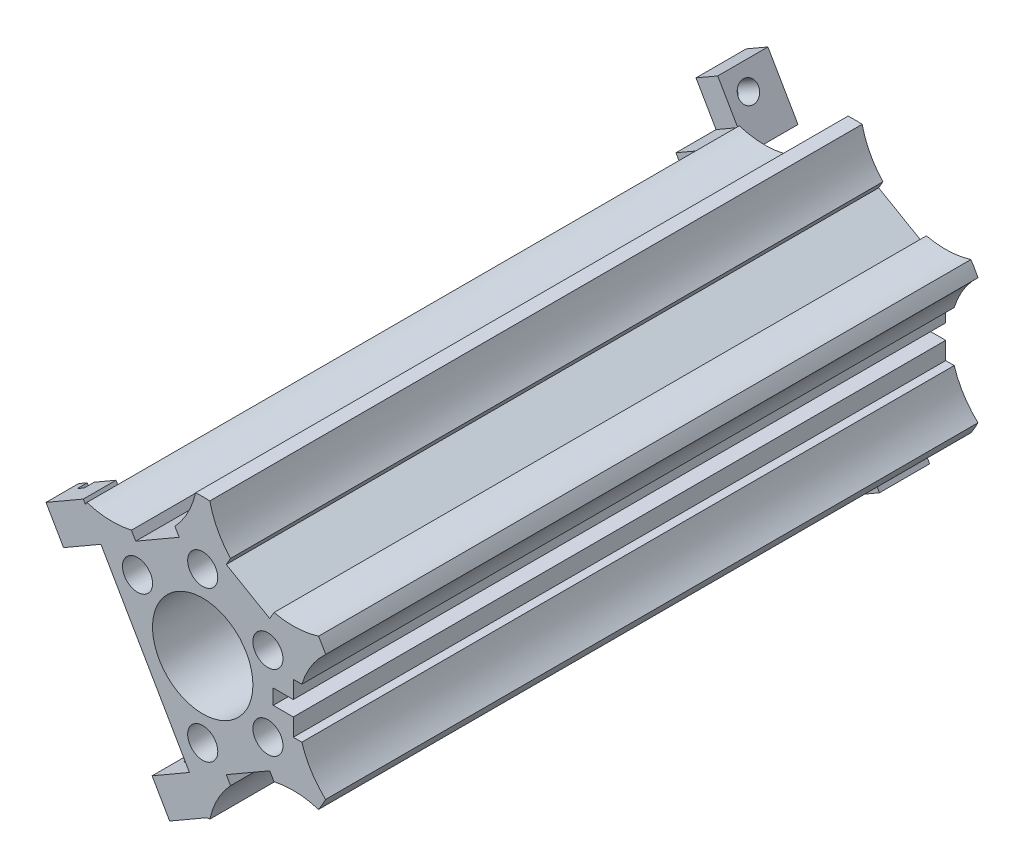
from build123d import *

# Parameters (mm, degrees)
BOSS_EXTRU_1_DEPTH      = 130
ESQUISSE4_R             = 54.250129783
ESQUISSE4_R_2           = 27.5
ENL_V_MAT_EXTRU_1_DEPTH = 150.53980461
ESQUISSE5_R             = 10
ESQUISSE5_R_2           = 3
ENL_V_MAT_EXTRU_2_DEPTH = 136.114727886
BOSS_EXTRU_2_DEPTH      = 5
ESQUISSE6_R             = 2
ENL_V_MAT_EXTRU_3_DEPTH = 140.046443052
BOSS_EXTRU_3_DEPTH      = 49.27879
ENL_V_START             = -8.6
ESQUISSE9_W             = 6.5
ESQUISSE9_H             = 35.278790482
ESQUISSE9_W_2           = 18
ESQUISSE9_H_2           = 40.466483264
ENL_V_MAT_EXTRU_4_DEPTH = 8.6


with BuildPart() as part:
    # Esquisse1 → Boss.-Extru.1 (new body)
    with BuildSketch(Plane.XY):
        with BuildLine():
            Line((-18, -51.176914536), (-18, -48.176914536))
            ThreePointArc((-18, -48.176914536), (-9.5, -16.454482672), (-32.722431864, -39.676914536))
            Line((-32.722431864, -39.676914536), (-35.320508076, -41.176914536))
            ThreePointArc((-35.320508076, -41.176914536), (-37.98683472, -30.451354144), (-34.549834435, -19.947356212))
            ThreePointArc((-34.549834435, -19.947356212), (-45.365063628, -17.671886805), (-53.320508076, -10))
            Line((-53.320508076, -10), (-50.722431864, -8.5))
            ThreePointArc((-50.722431864, -8.5), (-19, 0), (-50.722431864, 8.5))
            Line((-50.722431864, 8.5), (-53.320508076, 10))
            ThreePointArc((-53.320508076, 10), (-45.365063628, 17.671886805), (-34.549834435, 19.947356212))
            ThreePointArc((-34.549834435, 19.947356212), (-37.98683472, 30.451354144), (-35.320508076, 41.176914536))
            Line((-35.320508076, 41.176914536), (-32.722431864, 39.676914536))
            ThreePointArc((-32.722431864, 39.676914536), (-9.5, 16.454482672), (-18, 48.176914536))
            Line((-18, 48.176914536), (-18, 51.176914536))
            ThreePointArc((-18, 51.176914536), (-7.378228908, 48.123240948), (0, 39.894712423))
            ThreePointArc((0, 39.894712423), (7.378228908, 48.123240948), (18, 51.176914536))
            Line((18, 51.176914536), (18, 48.176914536))
            ThreePointArc((18, 48.176914536), (9.5, 16.454482672), (32.722431864, 39.676914536))
            Line((32.722431864, 39.676914536), (35.320508076, 41.176914536))
            ThreePointArc((35.320508076, 41.176914536), (37.98683472, 30.451354144), (34.549834435, 19.947356212))
            ThreePointArc((34.549834435, 19.947356212), (45.365063628, 17.671886805), (53.320508076, 10))
            Line((53.320508076, 10), (50.722431864, 8.5))
            ThreePointArc((50.722431864, 8.5), (19, 0), (50.722431864, -8.5))
            Line((50.722431864, -8.5), (53.320508076, -10))
            ThreePointArc((53.320508076, -10), (45.365063628, -17.671886805), (34.549834435, -19.947356212))
            ThreePointArc((34.549834435, -19.947356212), (37.98683472, -30.451354144), (35.320508076, -41.176914536))
            Line((35.320508076, -41.176914536), (32.722431864, -39.676914536))
            ThreePointArc((32.722431864, -39.676914536), (9.5, -16.454482672), (18, -48.176914536))
            Line((18, -48.176914536), (18, -51.176914536))
            ThreePointArc((18, -51.176914536), (7.378228908, -48.123240948), (0, -39.894712423))
            ThreePointArc((0, -39.894712423), (-7.378228908, -48.123240948), (-18, -51.176914536))
        make_face()
    extrude(amount=BOSS_EXTRU_1_DEPTH)

    # Esquisse4 → Enlèv. mat.-Extru.1 (cut, through all)
    with BuildSketch(Plane.XY.offset(130)):
        Circle(ESQUISSE4_R)
        Circle(ESQUISSE4_R_2, mode=Mode.SUBTRACT)
    extrude(amount=-ENL_V_MAT_EXTRU_1_DEPTH, mode=Mode.SUBTRACT)

    # Esquisse5 → Enlèv. mat.-Extru.2 (cut, through all)
    with BuildSketch(Plane.XY.offset(130)):
        Circle(ESQUISSE5_R)
        with Locations((0, 15)):
            Circle(ESQUISSE5_R_2)
        with Locations((12.990381057, 7.5)):
            Circle(ESQUISSE5_R_2)
        with Locations((12.990381057, -7.5)):
            Circle(ESQUISSE5_R_2)
        with Locations((0, -15)):
            Circle(ESQUISSE5_R_2)
        with Locations((-12.990381057, 7.5)):
            Circle(ESQUISSE5_R_2)
        Polygon((14.206088614, -14.605667257), (5.545834576, -19.605667257), (4.695834576, -18.13342407), (13.356088614, -13.13342407), align=None)
        Polygon((18.051923191, 5), (19.751923191, 5), (19.751923191, -5), (18.051923191, -5), (18.051923191, -1.5), (14.051923191, -1.5), (14.051923191, 1.5), (18.051923191, 1.5), align=None)
        Polygon((-14.206088614, 14.605667257), (-5.545834576, 19.605667257), (-4.695834576, 18.13342407), (-13.356088614, 13.13342407), align=None)
        Polygon((5.545834576, 19.605667257), (14.206088614, 14.605667257), (13.356088614, 13.13342407), (4.695834576, 18.13342407), align=None)
        Polygon((0.986461417, -27.708601295), (-23.503121916, 14.708601295), (-40.823629992, 4.708601295), (-16.334046658, -37.708601295), align=None)
    extrude(amount=-ENL_V_MAT_EXTRU_2_DEPTH, mode=Mode.SUBTRACT)

    # Esquisse7 → Boss.-Extru.2 (add)
    with BuildSketch(Plane(origin=(-11.258330249, -6.5, 0), x_dir=(0, 0, 1), z_dir=(-0.8660254037844403, -0.49999999999999717, 0))):
        Polygon((8, 24.233241632), (0, 24.233241632), (0, 32.233241632), (-10, 32.233241632), (-10, -32.233241632), (0, -32.233241632), (0, -24.233241632), (8, -24.233241632), align=None)
    extrude(amount=BOSS_EXTRU_2_DEPTH)

    # Esquisse6 → Enlèv. mat.-Extru.3 (cut, through all)
    with BuildSketch(Plane(origin=(-11.258330249, -6.5, 0), x_dir=(0, 0, 1), z_dir=(-0.8660254037844403, -0.49999999999999717, 0))):
        with Locations(Location((-4, 28, 0), (0, 0, 270))):
            Circle(ESQUISSE6_R)
        with Locations(Location((-4, -28, 0), (0, 0, 90))):
            Circle(ESQUISSE6_R)
    extrude(amount=ENL_V_MAT_EXTRU_3_DEPTH, mode=Mode.SUBTRACT)

    # Esquisse8 → Boss.-Extru.3 (add)
    with BuildSketch(Plane(origin=(12.116620816, -20.986602869, 0), x_dir=(0.8660254037844403, 0.4999999999999971, 0), z_dir=(0.49999999999999717, -0.8660254037844404, 0))):
        Polygon((-13, 130), (-21.6, 130), (-21.6, 123.5), (-19.6, 123.5), (-19.6, 125.5), (-18, 125.5), (-18, 123.5), (-13, 123.5), align=None)
    extrude(amount=-BOSS_EXTRU_3_DEPTH)

    # Esquisse9 → Enlèv. mat.-Extru.4 (cut)
    with BuildSketch(Plane(origin=(-18.706148722, -10.8, 0), x_dir=(0, 0, 1), z_dir=(-0.8660254037844403, -0.49999999999999734, 0)).offset(ENL_V_START)):
        with Locations((126.75, 0.406153609)):
            Rectangle(ESQUISSE9_W, ESQUISSE9_H)
        with Locations((-1, 0)):
            Rectangle(ESQUISSE9_W_2, ESQUISSE9_H_2)
    extrude(amount=ENL_V_MAT_EXTRU_4_DEPTH, mode=Mode.SUBTRACT)


solid = part.part
